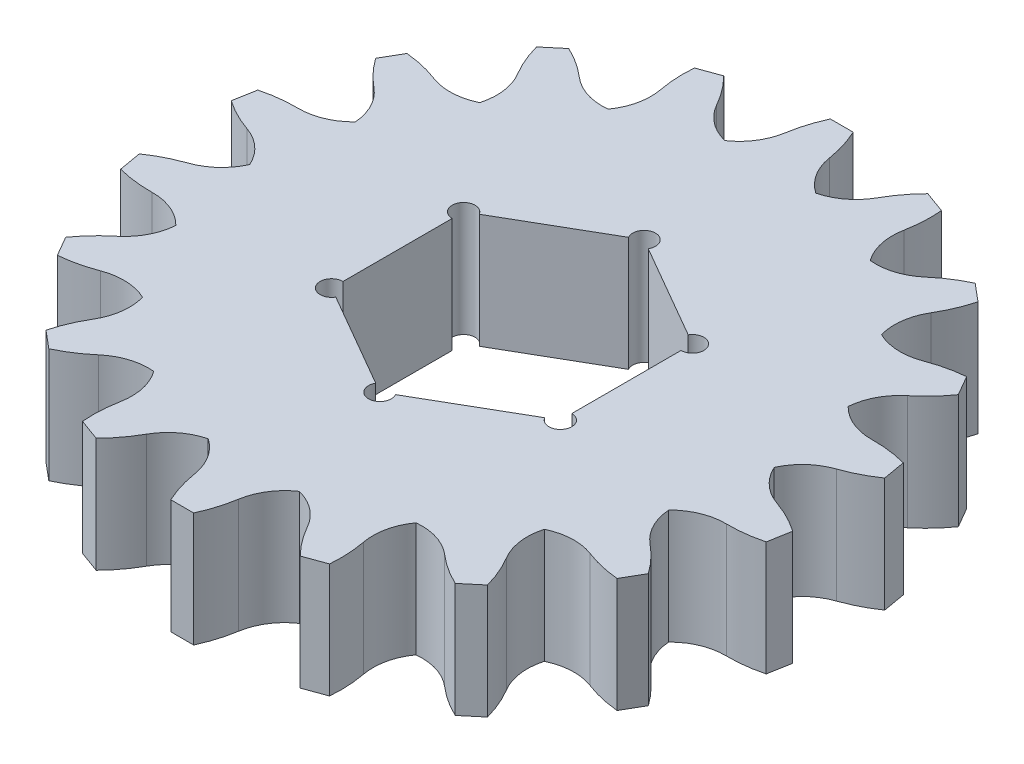
from build123d import *

# Parameters (mm, degrees)
BOSS_EXTRUDE1_DEPTH = 5
CIRPATTERN2_COUNT   = 18
BOSS_EXTRUDE3_DEPTH = 5


with BuildPart() as part:
    # Sketch1 → Boss-Extrude1 (new body)
    with BuildSketch(Plane(origin=(0, 0, 0), x_dir=(1, 0, 0), z_dir=(0, 1, 0))):
        with BuildLine():
            Line((0.5, 14.415439282), (-0.5, 14.415439282))
            ThreePointArc((-0.5, 14.415439282), (-0.952778657, 12.949235725), (-1, 11.415439282))
            Line((-1, 11.415439282), (1, 11.415439282))
            ThreePointArc((1, 11.415439282), (0.952778657, 12.949235725), (0.5, 14.415439282))
        make_face()
        with BuildLine():
            Line((0, 12.915439282), (0.9583076, 12.915439282))
            ThreePointArc((0.9583076, 12.915439282), (1.309947673, 11.991364327), (2, 11.283273195))
            Line((2, 11.283273195), (-2, 11.283273195))
            ThreePointArc((-2, 11.283273195), (-1.309947673, 11.991364327), (-0.9583076, 12.915439282))
            Line((-0.9583076, 12.915439282), (0, 12.915439282))
        make_face()
    boss_extrude1 = extrude(amount=BOSS_EXTRUDE1_DEPTH)

    # CirPattern2: Boss-Extrude1 ×18 about axis
    cirpattern2_axis = Axis((0, 0, 0), (0, 1, 0))
    for i in range(1, CIRPATTERN2_COUNT):
        add(boss_extrude1.rotate(cirpattern2_axis, i * 360 / CIRPATTERN2_COUNT))

    # Sketch1<5> → Boss-Extrude3 (add)
    with BuildSketch(Plane(origin=(0, 0, 0), x_dir=(1, 0, 0), z_dir=(0, 1, 0))):
        with BuildLine():
            ThreePointArc((11.459155903, 0), (8.781530784, 7.361859215), (2, 11.283273195))
            Line((2, 11.283273195), (-2, 11.283273195))
            ThreePointArc((-2, 11.283273195), (-7.361859215, -8.781530784), (11.459155903, 0))
        make_face()
        with BuildLine():
            Line((-0.433012702, -5.523502692), (-2.500000064, -4.330126982))
            Line((-2.500000064, -4.330126982), (-4.566987298, -3.136751346))
            ThreePointArc((-4.566987298, -3.136751346), (-5.433012702, -3.136751346), (-5, -2.386751346))
            Line((-5, -2.386751346), (-5, -2e-09))
            Line((-5, -2e-09), (-5, 2.386751346))
            ThreePointArc((-5, 2.386751346), (-5.433012702, 3.136751346), (-4.566987298, 3.136751346))
            Line((-4.566987298, 3.136751346), (-2.499999953, 4.330127046))
            Line((-2.499999953, 4.330127046), (-0.433012702, 5.523502692))
            ThreePointArc((-0.433012702, 5.523502692), (-0.129409523, 6.256465605), (0.5, 5.773502692))
            ThreePointArc((0.5, 5.773502692), (0.482962913, 5.644093169), (0.433012702, 5.523502692))
            Line((0.433012702, 5.523502692), (2.500000011, 4.330127013))
            Line((2.500000011, 4.330127013), (4.566987298, 3.136751346))
            ThreePointArc((4.566987298, 3.136751346), (5.129409523, 3.369714259), (5.5, 2.886751346))
            ThreePointArc((5.5, 2.886751346), (5.353553391, 2.533197955), (5, 2.386751346))
            Line((5, 2.386751346), (5, 0))
            Line((5, 0), (5, -2.386751346))
            ThreePointArc((5, -2.386751346), (5.353553391, -2.533197955), (5.5, -2.886751346))
            ThreePointArc((5.5, -2.886751346), (5.129409523, -3.369714259), (4.566987298, -3.136751346))
            Line((4.566987298, -3.136751346), (2.499999978, -4.330127032))
            Line((2.499999978, -4.330127032), (0.433012702, -5.523502692))
            ThreePointArc((0.433012702, -5.523502692), (0.482962913, -5.644093169), (0.5, -5.773502692))
            ThreePointArc((0.5, -5.773502692), (-0.129409523, -6.256465605), (-0.433012702, -5.523502692))
        make_face(mode=Mode.SUBTRACT)
    extrude(amount=BOSS_EXTRUDE3_DEPTH)


solid = part.part
